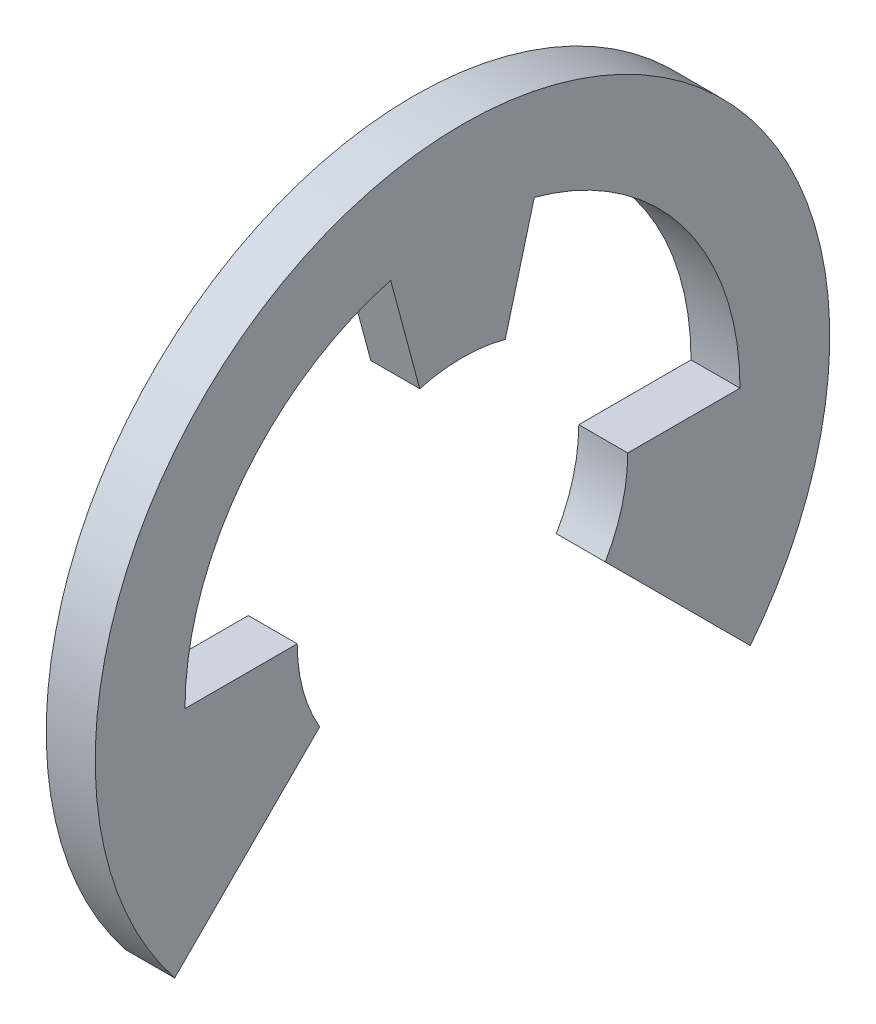
from build123d import *

# Parameters (mm, degrees)
BOSS_EXTRUDE1_DEPTH = 0.6


with BuildPart() as part:
    # Sketch1 → Boss-Extrude1 (new body)
    with BuildSketch(Plane(origin=(0, 0, 0), x_dir=(0, 0, -1), z_dir=(1, 0, 0))):
        with BuildLine():
            Line((-2.025, 0), (-3.4, 0))
            ThreePointArc((-3.4, 0), (-2.697401357, 2.069788859), (-0.879984753, 3.284147809))
            Line((-0.879984753, 3.284147809), (-0.524108566, 1.955999798))
            ThreePointArc((-0.524108566, 1.955999798), (0, 2.025), (0.524108566, 1.955999798))
            Line((0.524108566, 1.955999798), (0.879984753, 3.284147809))
            ThreePointArc((0.879984753, 3.284147809), (2.697401357, 2.069788859), (3.4, 0))
            Line((3.4, 0), (2.025, 0))
            ThreePointArc((2.025, 0), (1.95504156, -0.527671773), (1.75, -1.018884194))
            Line((1.75, -1.018884194), (3.526470338, -2.795354531))
            ThreePointArc((3.526470338, -2.795354531), (0, 4.5), (-3.526470338, -2.795354531))
            Line((-3.526470338, -2.795354531), (-1.75, -1.018884194))
            ThreePointArc((-1.75, -1.018884194), (-1.95504156, -0.527671773), (-2.025, 0))
        make_face()
    extrude(amount=BOSS_EXTRUDE1_DEPTH)


solid = part.part
